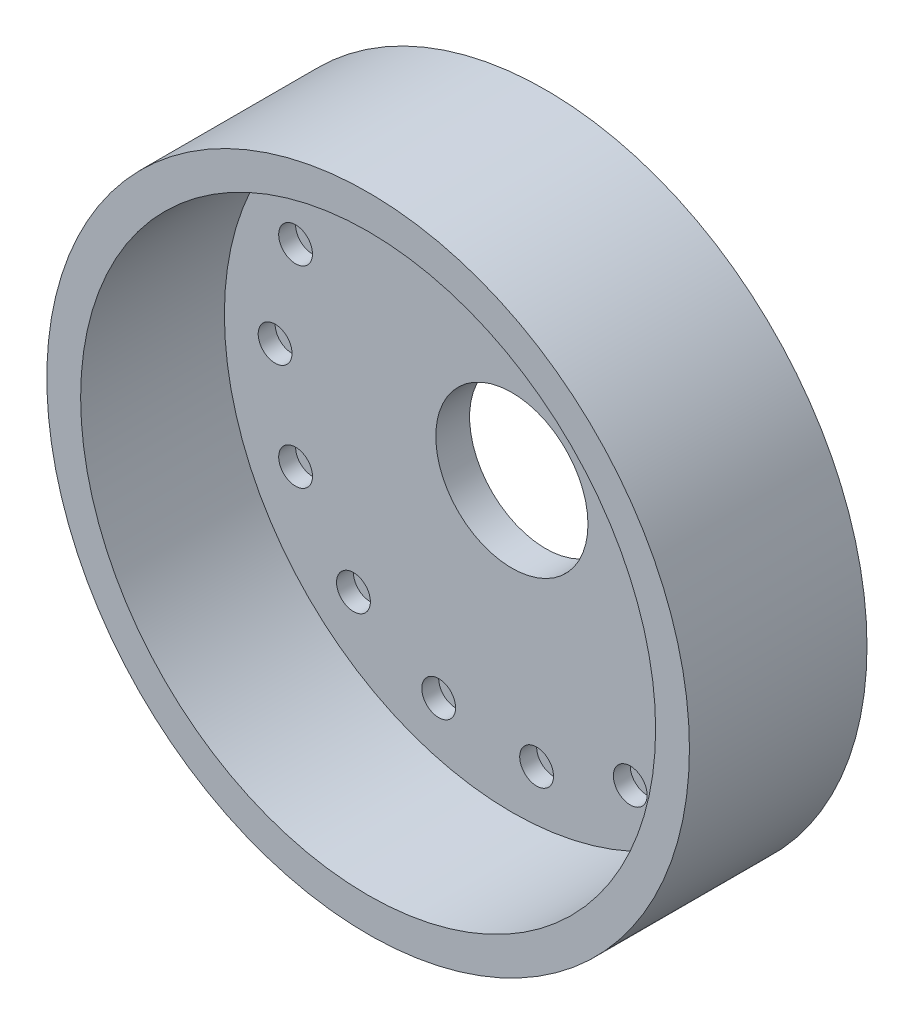
from build123d import *

# Parameters (mm, degrees)
SKETCH1_R           = 60.325
BOSS_EXTRUDE1_DEPTH = 33.3375
SKETCH2_R           = 53.975
CUT_EXTRUDE1_DEPTH  = 26.9875
SKETCH3_R           = 3.175
CUT_EXTRUDE2_DEPTH  = 3.175
SKETCH4_R           = 14.2875
CUT_EXTRUDE3_DEPTH  = 90.479251261


with BuildPart() as part:
    # Sketch1 → Boss-Extrude1 (new body)
    with BuildSketch(Plane.XY):
        Circle(SKETCH1_R)
    extrude(amount=BOSS_EXTRUDE1_DEPTH)

    # Sketch2 → Cut-Extrude1 (cut)
    with BuildSketch(Plane.XY.offset(33.3375)):
        Circle(SKETCH2_R)
    extrude(amount=-CUT_EXTRUDE1_DEPTH, mode=Mode.SUBTRACT)

    # Sketch3 → Cut-Extrude2 (cut)
    with BuildSketch(Plane.XY.offset(6.35)):
        with Locations((-44.45, 0)):
            Circle(SKETCH3_R)
        with Locations((-40.607095592, 18.079443785)):
            Circle(SKETCH3_R)
        with Locations((-29.742855453, 33.032787492)):
            Circle(SKETCH3_R)
        with Locations((-13.7358054, 42.274462149)):
            Circle(SKETCH3_R)
        with Locations((4.646290192, 44.206498249)):
            Circle(SKETCH3_R)
        with Locations((22.225, 38.494829198)):
            Circle(SKETCH3_R)
        with Locations((35.9608054, 26.127054464)):
            Circle(SKETCH3_R)
        with Locations((43.478660853, 9.241674657)):
            Circle(SKETCH3_R)
        with Locations((43.478660853, -9.241674657)):
            Circle(SKETCH3_R)
        with Locations((35.9608054, -26.127054464)):
            Circle(SKETCH3_R)
        with Locations((22.225, -38.494829198)):
            Circle(SKETCH3_R)
        with Locations((4.646290192, -44.206498249)):
            Circle(SKETCH3_R)
        with Locations((-13.7358054, -42.274462149)):
            Circle(SKETCH3_R)
        with Locations((-29.742855453, -33.032787492)):
            Circle(SKETCH3_R)
        with Locations((-40.607095592, -18.079443785)):
            Circle(SKETCH3_R)
    extrude(amount=-CUT_EXTRUDE2_DEPTH, mode=Mode.SUBTRACT)

    # Sketch4 → Cut-Extrude3 (cut, through all)
    with BuildSketch(Plane.XY.offset(6.35)):
        Circle(SKETCH4_R)
    extrude(amount=-CUT_EXTRUDE3_DEPTH, mode=Mode.SUBTRACT)


solid = part.part
